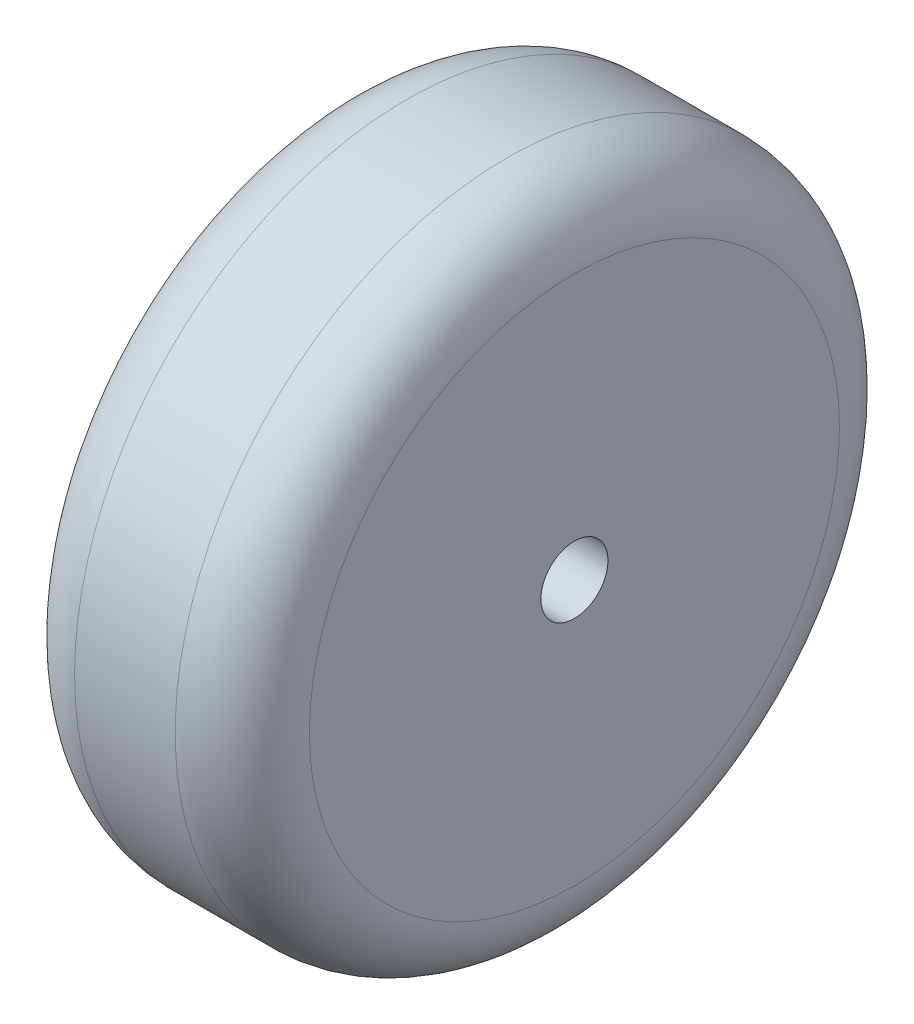
from build123d import *

# Parameters (mm, degrees)
RACCORDO1_R                  = 20
ESTRUSIONE_ESTRUSIONE1_START = 1
ESTRUSIONE_ESTRUSIONE1_DEPTH = 1


with BuildPart() as part:
    # Schizzo1 → Rivoluzione1 (revolve)
    with BuildSketch(Plane.XY):
        Polygon((-35, 98.99999999999999), (35, 98.99999999999999), (35.000000000000014, 9.999999999999995), (15.510000000000021, 9.999999999999996), (15.51000000000002, 17.499999999999996), (4.510000000000019, 17.499999999999996), (4.510000000000019, 32.49999999999999), (-28.38999999999998, 32.49999999999998), (-28.38999999999998, 56.74999999999999), (-35, 56.74999999999999), align=None)
    revolve(axis=Axis((44.99999999999999, 0, 0), (-1, 0, 0)))

    # Raccordo1
    raccordo1_edges = [part.edges().sort_by_distance(p)[0] for p in [
        (35, -98.99999999999999, -1.212e-14),
        (-35.00000000000001, -98.99999999999999, -1.212e-14),
    ]]
    fillet(raccordo1_edges, radius=RACCORDO1_R)

    # Schizzo2 → Estrusione-Estrusione1 (add)
    with BuildSketch(Plane.ZY.offset(35).offset(ESTRUSIONE_ESTRUSIONE1_START)):
        with BuildLine():
            Line((-5, 66.52930655863382), (5, 66.52930655863382))
            Line((5, 66.52930655863382), (5, 56.52930655863382))
            ThreePointArc((5, 56.52930655863382), (3.47e-15, 56.75000000000001), (-4.999999999999998, 56.52930655863382))
            Line((-4.999999999999998, 56.52930655863382), (-5, 66.52930655863382))
        make_face()
    extrude(amount=-ESTRUSIONE_ESTRUSIONE1_DEPTH)


solid = part.part
